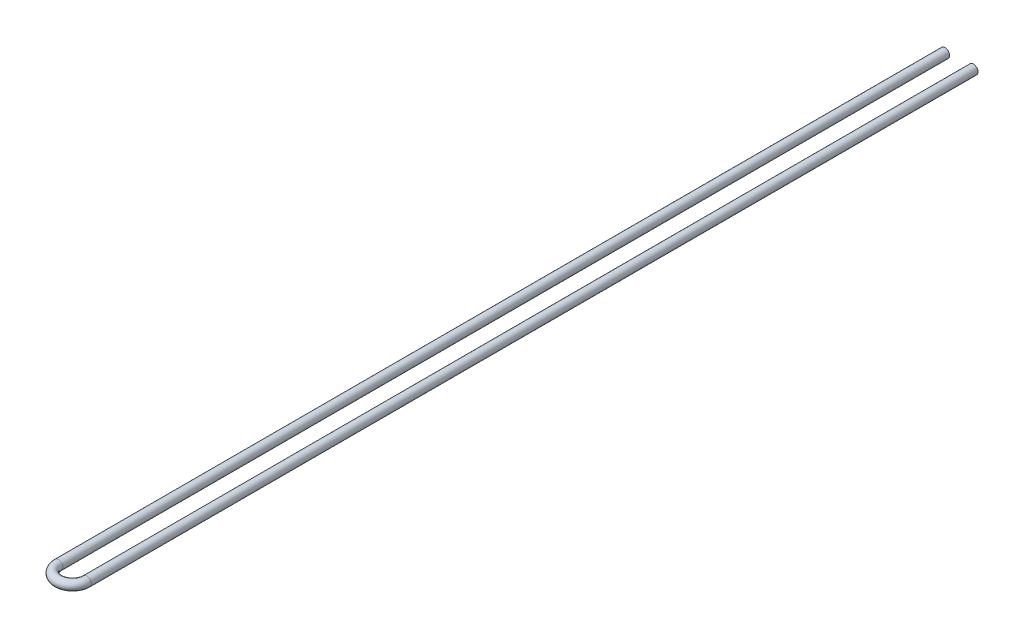
from build123d import *

# Parameters (mm, degrees)
SKETCH2_R   = 11.1
SKETCH2_R_2 = 9.95


with BuildPart() as part:
    # Sweep1: sweep along a path in Sketch1
    with BuildLine(Plane(origin=(0, 0, 0), x_dir=(1, 0, 0), z_dir=(0, 1, 0))) as sweep1_path:
        Line((28.62, -300), (28.62, -2440))
        ThreePointArc((28.62, -2440), (-5.69, -2474.31), (-40, -2440))
        Line((-40, -2440), (-40, -300))
    # Sketch2 → Sweep1 (sweep)
    with BuildSketch(Plane(origin=(28.62, 0, 300), x_dir=(-1, 0, 0), z_dir=(0, 0, -1))):
        Circle(SKETCH2_R)
        Circle(SKETCH2_R_2, mode=Mode.SUBTRACT)
    sweep(path=sweep1_path.line)


solid = part.part
